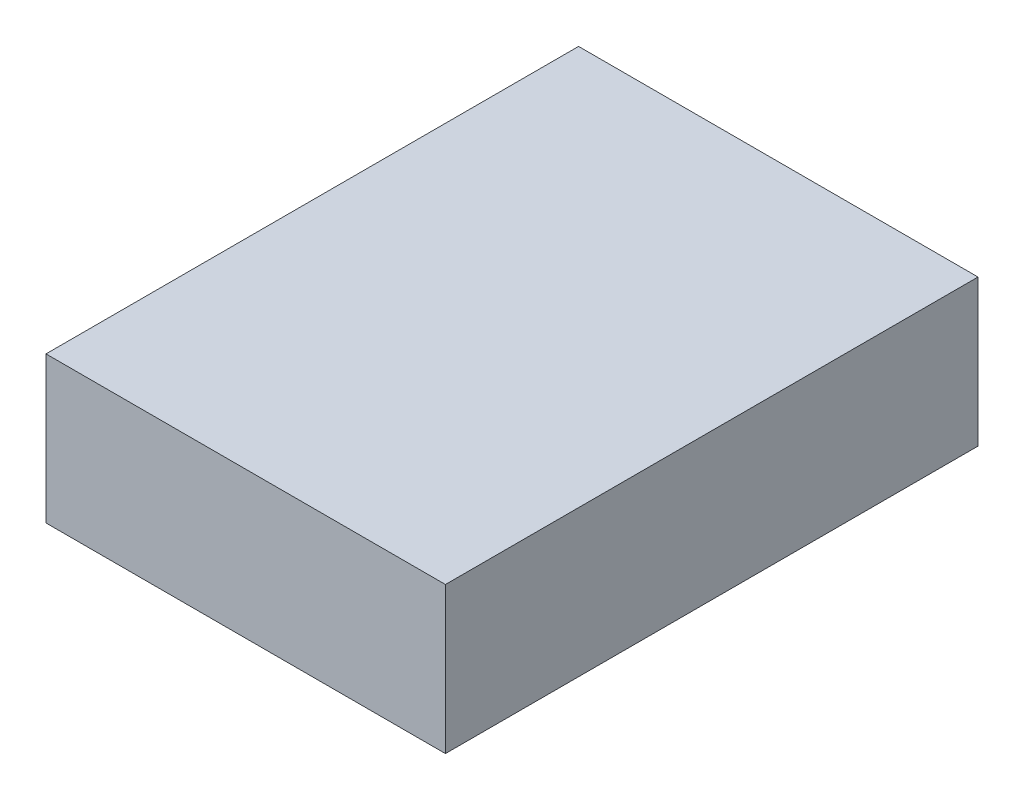
from build123d import *

# Parameters (mm, degrees)
SKETCH_1_W      = 60
SKETCH_1_H      = 80
EXTRUDE_1_DEPTH = 22


with BuildPart() as part:
    # 草图1 → 凸台-拉伸1 (new body)
    with BuildSketch(Plane(origin=(0, 0, 0), x_dir=(1, 0, 0), z_dir=(0, 1, 0))):
        with Locations((30, -40)):
            Rectangle(SKETCH_1_W, SKETCH_1_H)
    extrude(amount=EXTRUDE_1_DEPTH)


solid = part.part
